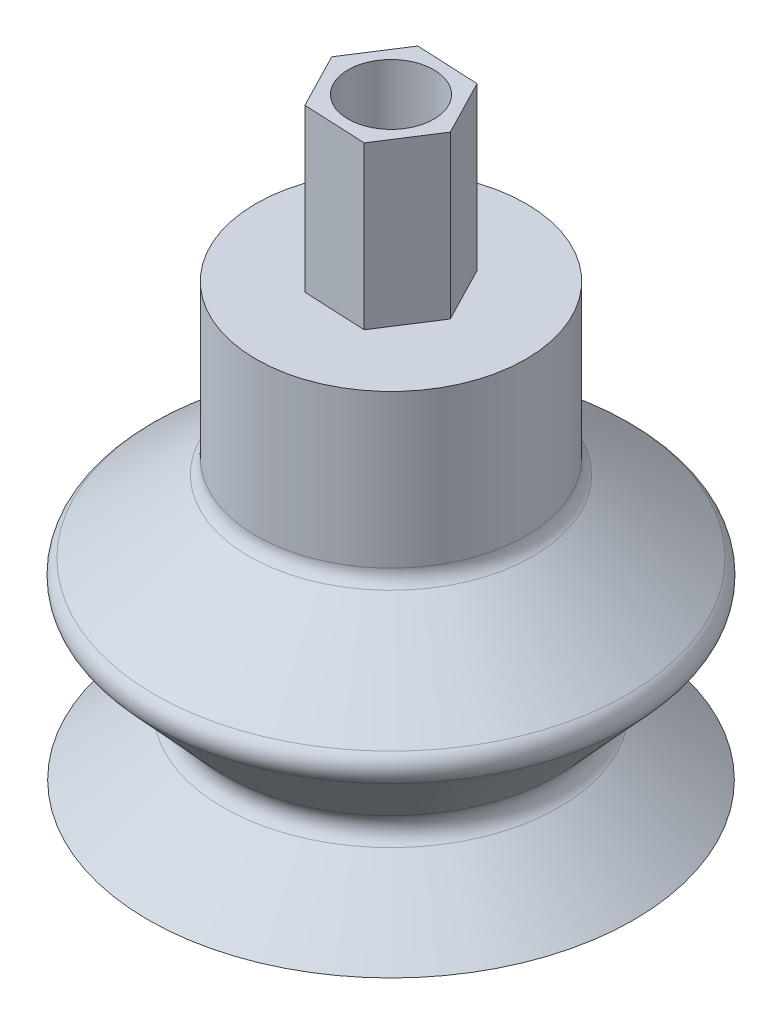
from build123d import *

# Parameters (mm, degrees)
CASCA1_T                 = -0.9
RESSALTO_EXTRUS_O1_DEPTH = 9
FILETE1_R                = 1
ESBO_O3_R                = 2.38125
CORTE_EXTRUS_O1_DEPTH    = 39.143338529
ESQUISSE1_R              = 6.732461852
ENL_V_MAT_EXTRU_1_DEPTH  = 9


with BuildPart() as part:
    # Esboço1 → Revolução1 (revolve)
    with BuildSketch(Plane.XY, mode=Mode.PRIVATE) as revolu_o1_sk:
        Polygon((0, 0), (13.5, 0), (8.5, 4), (14, 10), (7.5, 15), (7.5, 24), (0, 24), align=None)
    revolve(revolu_o1_sk.sketch.rotate(Axis((0, 24, 0), (0, -1, 0)), 180), axis=Axis((0, 24, 0), (0, -1, 0)))

    # Casca1
    casca1_openings = [part.faces().sort_by_distance(p)[0] for p in [
        (0, 0, 0),
    ]]
    offset(amount=CASCA1_T, openings=casca1_openings, kind=Kind.INTERSECTION)

    # Esboço2 → Ressalto-extrusão1 (add)
    with BuildSketch(Plane(origin=(0, 24, 0), x_dir=(1, 0, 0), z_dir=(0, 1, 0))):
        Polygon((2.496763598, 3.885808136), (-2.11682676, 4.105164771), (-4.613590359, 0.219356636), (-2.496763598, -3.885808136), (2.11682676, -4.105164771), (4.613590359, -0.219356636), align=None)
    extrude(amount=RESSALTO_EXTRUS_O1_DEPTH)

    # Filete1
    filete1_edges = [part.edges().sort_by_distance(p)[0] for p in [
        (7.5, 15, 0),
        (14, 10, 0),
        (8.5, 4, 0),
    ]]
    fillet(filete1_edges, radius=FILETE1_R)

    # Esboço3 → Corte-extrusão1 (cut, through all)
    with BuildSketch(Plane(origin=(0, 33, 0), x_dir=(1, 0, 0), z_dir=(0, 1, 0))):
        with Locations(Location((0, 0, 0), (0, 0, 270))):
            Circle(ESBO_O3_R)
    extrude(amount=-CORTE_EXTRUS_O1_DEPTH, mode=Mode.SUBTRACT)

    # Esquisse1 → Enlèv. mat.-Extru.1 (cut)
    with BuildSketch(Plane(origin=(0, 33, 0), x_dir=(1, 0, 0), z_dir=(0, 1, 0))):
        Circle(ESQUISSE1_R)
        Polygon((1.58762007, -3.078873578), (3.460192769, -0.164517477), (1.872572699, 2.914356102), (-1.58762007, 3.078873578), (-3.460192769, 0.164517477), (-1.872572699, -2.914356102), align=None, mode=Mode.SUBTRACT)
    extrude(amount=-ENL_V_MAT_EXTRU_1_DEPTH, mode=Mode.SUBTRACT)


solid = part.part
